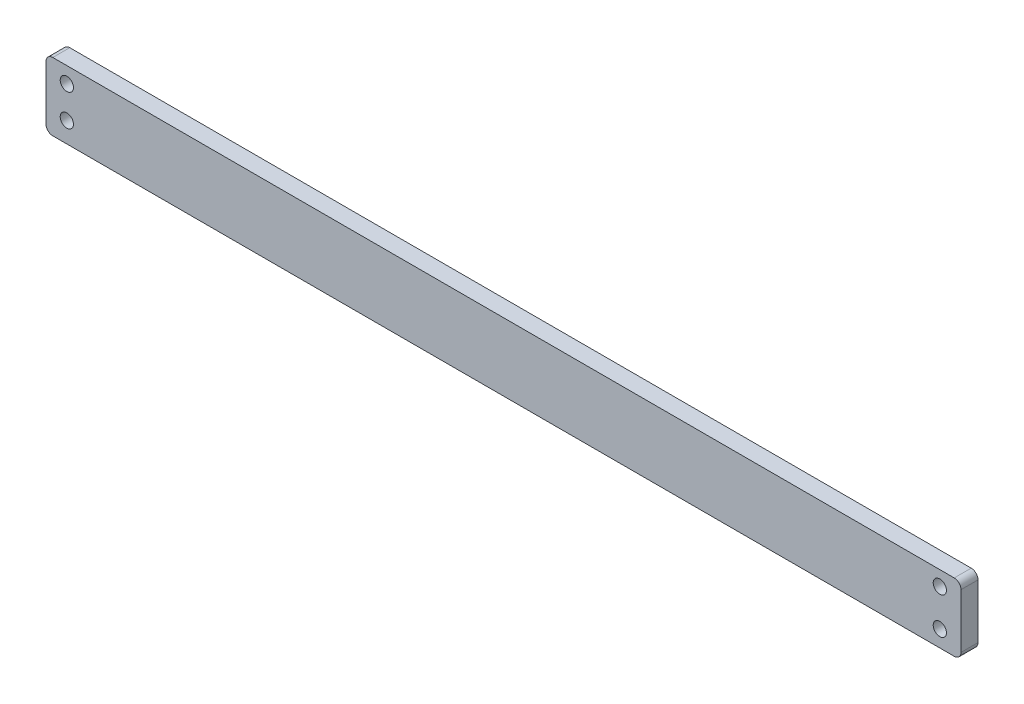
from build123d import *

# Parameters (mm, degrees)
SKETCH1_R           = 1.95
BOSS_EXTRUDE1_DEPTH = 5


with BuildPart() as part:
    # Sketch1 → Boss-Extrude1 (new body)
    with BuildSketch(Plane.XY):
        with BuildLine():
            Line((-3.514372136, 36.815496517), (262.040865352, 36.815496517))
            ThreePointArc((262.040865352, 36.815496517), (263.455078915, 37.401282955), (264.040865352, 38.815496517))
            Line((264.040865352, 38.815496517), (264.040865352, 54.815496517))
            ThreePointArc((264.040865352, 54.815496517), (263.455078915, 56.229710079), (262.040865352, 56.815496517))
            Line((262.040865352, 56.815496517), (-3.514372136, 56.815496517))
            ThreePointArc((-3.514372136, 56.815496517), (-4.928585698, 56.229710079), (-5.514372136, 54.815496517))
            Line((-5.514372136, 54.815496517), (-5.514372136, 38.815496517))
            ThreePointArc((-5.514372136, 38.815496517), (-4.928585698, 37.401282955), (-3.514372136, 36.815496517))
        make_face()
        with Locations((0.62126005, 42.807729827)):
            Circle(SKETCH1_R, mode=Mode.SUBTRACT)
        with Locations((0.62126005, 52.156372628)):
            Circle(SKETCH1_R, mode=Mode.SUBTRACT)
        with Locations((257.791885291, 41.668699963)):
            Circle(SKETCH1_R, mode=Mode.SUBTRACT)
        with Locations((257.791885291, 52.481050085)):
            Circle(SKETCH1_R, mode=Mode.SUBTRACT)
    extrude(amount=BOSS_EXTRUDE1_DEPTH)


solid = part.part
